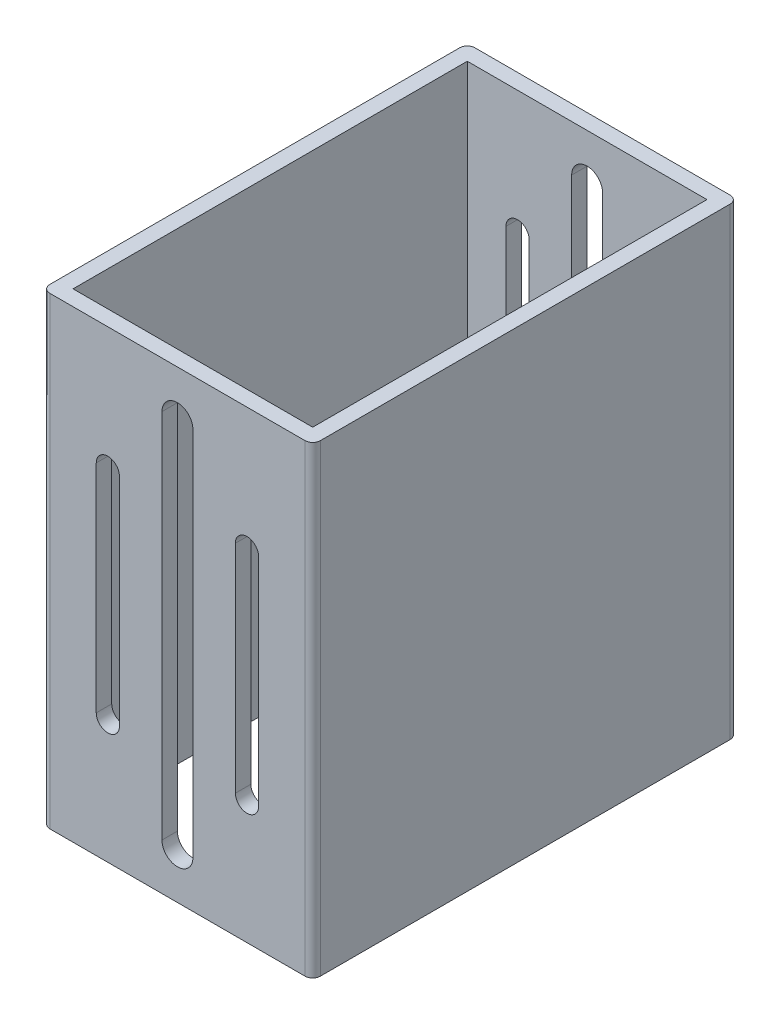
from build123d import *

# Parameters (mm, degrees)
SKETCH1_W           = 31
SKETCH1_H           = 51
BOSS_EXTRUDE1_DEPTH = 60
CUT_EXTRUDE1_DEPTH  = 60


with BuildPart() as part:
    # Sketch1 → Boss-Extrude1 (new body)
    with BuildSketch(Plane(origin=(0, 0, 0), x_dir=(1, 0, 0), z_dir=(0, 1, 0))):
        with BuildLine():
            Line((0, 1), (0, 54))
            ThreePointArc((0, 54), (0.292893219, 54.707106781), (1, 55))
            Line((1, 55), (34, 55))
            ThreePointArc((34, 55), (34.707106781, 54.707106781), (35, 54))
            Line((35, 54), (35, 1))
            ThreePointArc((35, 1), (34.707106781, 0.292893219), (34, 0))
            Line((34, 0), (1, 0))
            ThreePointArc((1, 0), (0.292893219, 0.292893219), (0, 1))
        make_face()
        with Locations((17.5, 27.5)):
            Rectangle(SKETCH1_W, SKETCH1_H, mode=Mode.SUBTRACT)
    extrude(amount=BOSS_EXTRUDE1_DEPTH)

    # Sketch3 → Cut-Extrude1 (cut)
    with BuildSketch(Plane.XY):
        with BuildLine():
            Line((15.5, 54), (15.5, 6))
            ThreePointArc((15.5, 6), (17.5, 4), (19.5, 6))
            Line((19.5, 6), (19.5, 54))
            ThreePointArc((19.5, 54), (17.5, 56), (15.5, 54))
        make_face()
        with BuildLine():
            Line((28, 44), (28, 16))
            ThreePointArc((28, 16), (26.5, 14.5), (25, 16))
            Line((25, 16), (25, 44))
            ThreePointArc((25, 44), (26.5, 45.5), (28, 44))
        make_face()
        with BuildLine():
            Line((7, 44), (7, 16))
            ThreePointArc((7, 16), (8.5, 14.5), (10, 16))
            Line((10, 16), (10, 44))
            ThreePointArc((10, 44), (8.5, 45.5), (7, 44))
        make_face()
    extrude(amount=-CUT_EXTRUDE1_DEPTH, mode=Mode.SUBTRACT)


solid = part.part
